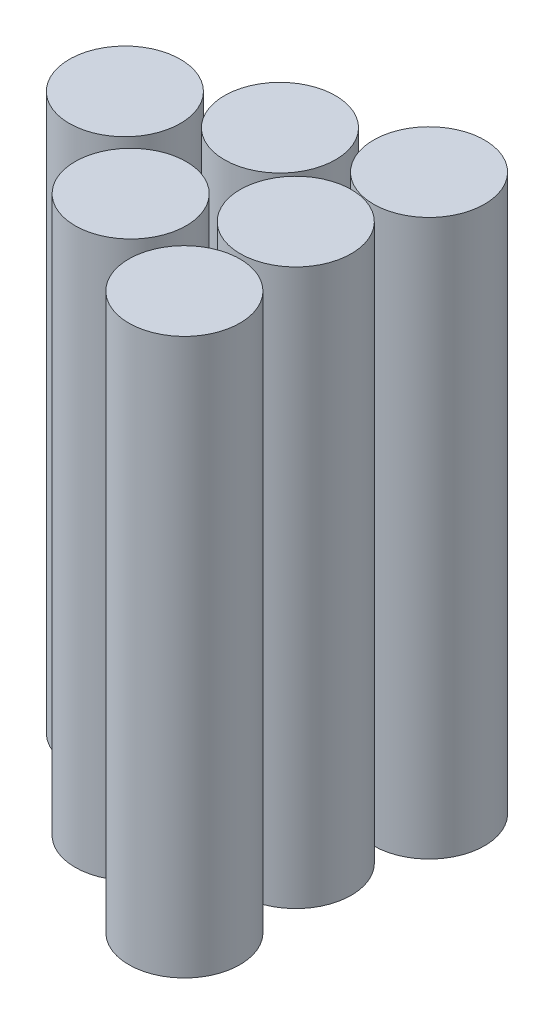
from build123d import *

# Parameters (mm, degrees)
SKETCH1_R             = 0.125
BOSS_EXTRUDE1_DEPTH   = 1.25
BOSS_EXTRUDE1_2_DEPTH = 1.25
BOSS_EXTRUDE1_3_DEPTH = 1.25
BOSS_EXTRUDE1_4_DEPTH = 1.25
BOSS_EXTRUDE1_5_DEPTH = 1.25
BOSS_EXTRUDE1_6_DEPTH = 1.25


with BuildPart() as part:
    # Sketch1 → Boss-Extrude1 (new body)
    with BuildSketch(Plane(origin=(0, 0, 0), x_dir=(1, 0, 0), z_dir=(0, 1, 0))):
        with Locations(Location((0, 0, 0), (0, 0, 270))):
            Circle(SKETCH1_R)
    extrude(amount=BOSS_EXTRUDE1_DEPTH)


with BuildPart() as body_2:
    # Sketch1 → Boss-Extrude1 2 (new body)
    with BuildSketch(Plane(origin=(0, 0, 0), x_dir=(1, 0, 0), z_dir=(0, 1, 0))):
        with Locations(Location((-0.200728238, 0.165210686, 0), (0, 0, 270))):
            Circle(SKETCH1_R)
    extrude(amount=BOSS_EXTRUDE1_2_DEPTH)


with BuildPart() as body_3:
    # Sketch1 → Boss-Extrude1 3 (new body)
    with BuildSketch(Plane(origin=(0, 0, 0), x_dir=(1, 0, 0), z_dir=(0, 1, 0))):
        with Locations(Location((0.053466013, 0.24638196, 0), (0, 0, 270))):
            Circle(SKETCH1_R)
    extrude(amount=BOSS_EXTRUDE1_3_DEPTH)


with BuildPart() as body_4:
    # Sketch1 → Boss-Extrude1 4 (new body)
    with BuildSketch(Plane(origin=(0, 0, 0), x_dir=(1, 0, 0), z_dir=(0, 1, 0))):
        with Locations(Location((-0.445926201, 0.061530931, 0), (0, 0, 270))):
            Circle(SKETCH1_R)
    extrude(amount=BOSS_EXTRUDE1_4_DEPTH)


with BuildPart() as body_5:
    # Sketch1 → Boss-Extrude1 5 (new body)
    with BuildSketch(Plane(origin=(0, 0, 0), x_dir=(1, 0, 0), z_dir=(0, 1, 0))):
        with Locations(Location((-0.240156126, -0.131235088, 0), (0, 0, 270))):
            Circle(SKETCH1_R)
    extrude(amount=BOSS_EXTRUDE1_5_DEPTH)


with BuildPart() as body_6:
    # Sketch1 → Boss-Extrude1 6 (new body)
    with BuildSketch(Plane(origin=(0, 0, 0), x_dir=(1, 0, 0), z_dir=(0, 1, 0))):
        with Locations(Location((0.009980731, -0.260510711, 0), (0, 0, 270))):
            Circle(SKETCH1_R)
    extrude(amount=BOSS_EXTRUDE1_6_DEPTH)


solid = Compound([part.part, body_2.part, body_3.part, body_4.part, body_5.part, body_6.part])
